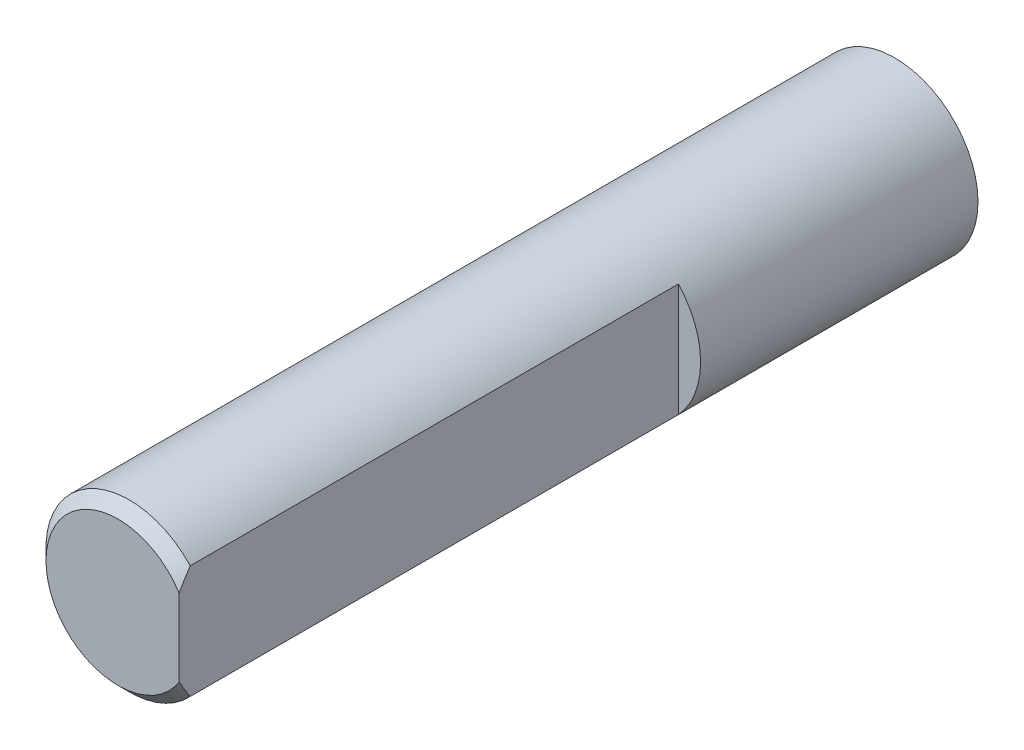
from build123d import *

# Parameters (mm, degrees)
SKETCH_1_R      = 1.5
EXTRUDE_1_DEPTH = 5
EXTRUDE_2_DEPTH = 9
CHAMFER_1_SIZE  = 0.2


with BuildPart() as part:
    # Эскиз1 → Бобышка-Вытянуть1 (new body)
    with BuildSketch(Plane.XY):
        Circle(SKETCH_1_R)
    extrude(amount=EXTRUDE_1_DEPTH)

    # Эскиз2 → Бобышка-Вытянуть2 (add)
    with BuildSketch(Plane.XY.offset(5)):
        with BuildLine():
            Line((1.1, 1.019803903), (1.1, -1.019803903))
            ThreePointArc((1.1, -1.019803903), (-1.5, 0), (1.1, 1.019803903))
        make_face()
    extrude(amount=EXTRUDE_2_DEPTH)

    # Фаска1
    chamfer_1_edges = [part.edges().sort_by_distance(p)[0] for p in [
        (-1.5, 0, 14),
    ]]
    chamfer(chamfer_1_edges, length=CHAMFER_1_SIZE)


solid = part.part
